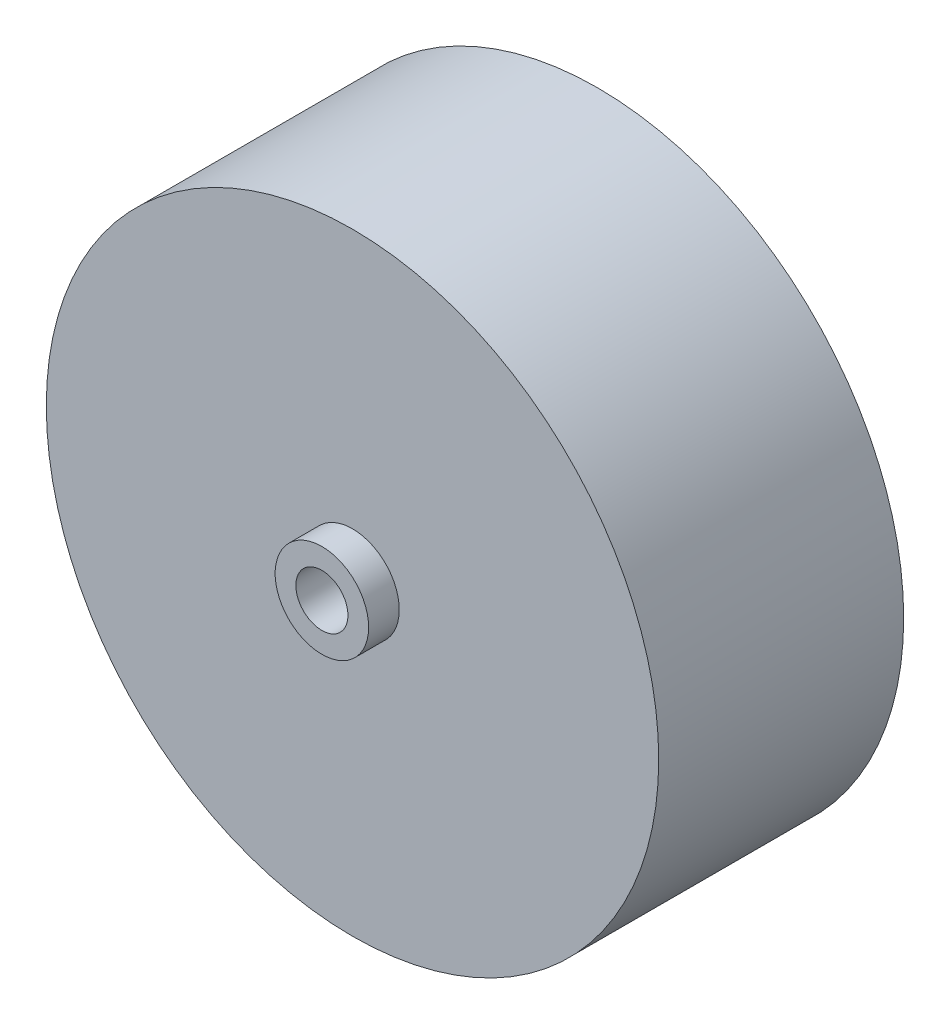
from build123d import *

# Parameters (mm, degrees)
SKETCH1_R           = 31.75
BOSS_EXTRUDE1_DEPTH = 25.4
SKETCH2_R           = 4.845598066
SKETCH2_R_2         = 2.7
BOSS_EXTRUDE2_DEPTH = 3.175
CUT_EXTRUDE1_REACH  = 53.588
SKETCH3_R           = 2.7


with BuildPart() as part:
    # Sketch1 → Boss-Extrude1 (new body)
    with BuildSketch(Plane.XY):
        Circle(SKETCH1_R)
    extrude(amount=BOSS_EXTRUDE1_DEPTH)

    # Sketch2 → Boss-Extrude2 (add)
    with BuildSketch(Plane.XY.offset(25.4)):
        Circle(SKETCH2_R)
        Circle(SKETCH2_R_2, mode=Mode.SUBTRACT)
    extrude(amount=BOSS_EXTRUDE2_DEPTH)

    # Sketch3 → Cut-Extrude1 (cut, up to next)
    with BuildSketch(Plane.XY.offset(25.4), mode=Mode.PRIVATE) as cut_extrude1_sk1:
        Circle(SKETCH3_R)
    cut_extrude1_tool1 = extrude(cut_extrude1_sk1.sketch, amount=-CUT_EXTRUDE1_REACH, mode=Mode.PRIVATE) & part.part
    add(cut_extrude1_tool1.solids().sort_by_distance((0, 0, 25.4))[0], mode=Mode.SUBTRACT)


solid = part.part
